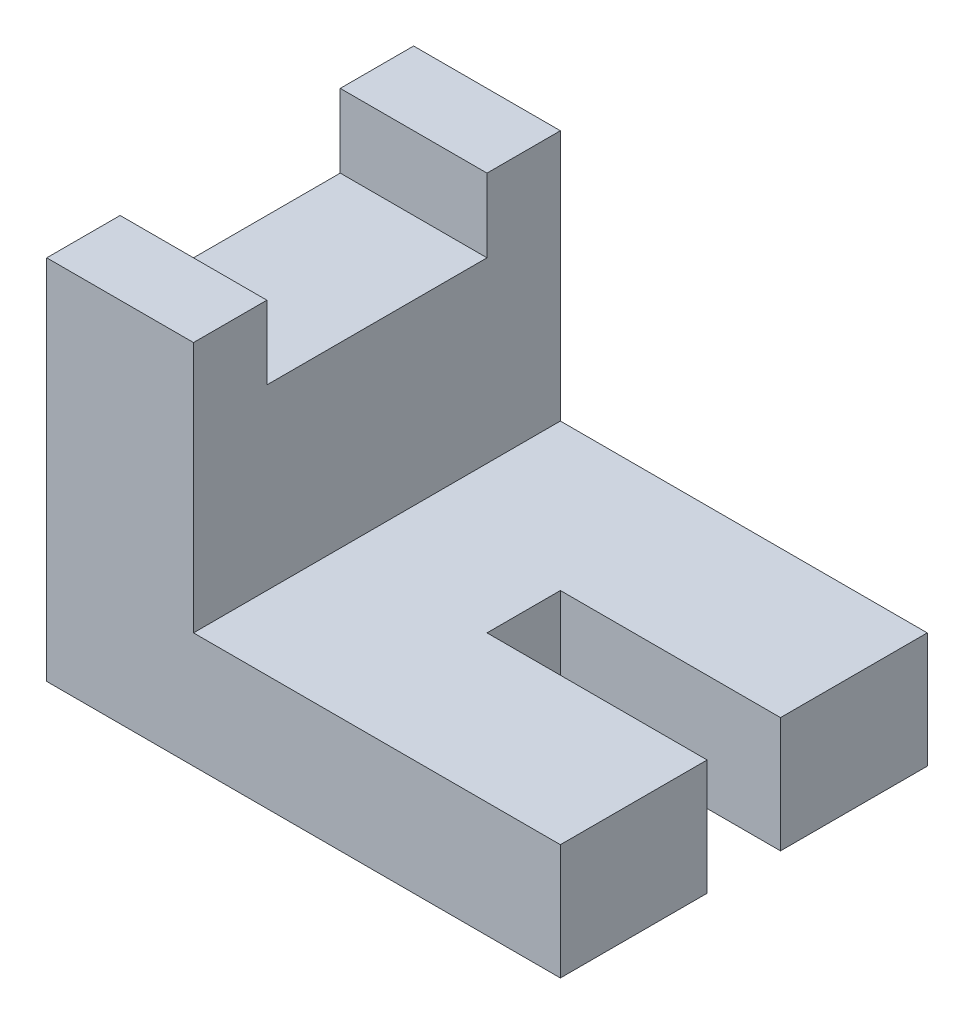
from build123d import *

# Parameters (mm, degrees)
BOSS_EXTRUDE1_DEPTH = 31.75
SKETCH3_W           = 12.7
SKETCH3_H           = 19.05
CUT_EXTRUDE1_DEPTH  = 6.35
SKETCH4_W           = 19.05
SKETCH4_H           = 6.35
CUT_EXTRUDE2_DEPTH  = 47.573244244


with BuildPart() as part:
    # Sketch2 → Boss-Extrude1 (new body)
    with BuildSketch(Plane.XY):
        Polygon((-18.228399123, 0), (26.221600877, 0), (26.221600877, 9.991502193), (-5.528399123, 9.991502193), (-5.528399123, 31.75), (-18.228399123, 31.75), align=None)
    extrude(amount=-BOSS_EXTRUDE1_DEPTH)

    # Sketch3 → Cut-Extrude1 (cut)
    with BuildSketch(Plane(origin=(0, 31.75, 0), x_dir=(1, 0, 0), z_dir=(0, 1, 0))):
        with Locations((-11.878399123, 15.875)):
            Rectangle(SKETCH3_W, SKETCH3_H)
    extrude(amount=-CUT_EXTRUDE1_DEPTH, mode=Mode.SUBTRACT)

    # Sketch4 → Cut-Extrude2 (cut, through all)
    with BuildSketch(Plane(origin=(0, 9.991502193, 0), x_dir=(1, 0, 0), z_dir=(0, 1, 0))):
        with Locations((16.696600877, 15.875)):
            Rectangle(SKETCH4_W, SKETCH4_H)
    extrude(amount=-CUT_EXTRUDE2_DEPTH, mode=Mode.SUBTRACT)


solid = part.part
